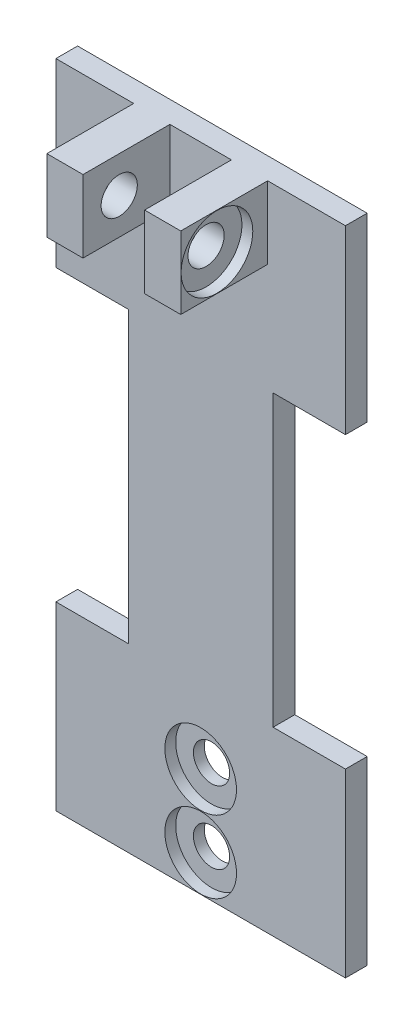
from build123d import *

# Parameters (mm, degrees)
SKETCH1_R             = 4.95
SKETCH1_W             = 5
SKETCH1_H             = 10
SKETCH1_W_2           = 8.5
BODY_DEPTH            = 3
SKETCH1_3_R           = 4.95
SKETCH1_3_R_2         = 2.5
MOUNT_INSETS_DEPTH    = 1.5
SKETCH1_5_W           = 5
SKETCH1_5_H           = 10
HINGE_DEPTH           = 15
SKETCH2_R             = 4.95
SKETCH2_R_2           = 2.5
HINGE_INSET_DEPTH     = 1.5
HINGE_START           = -17
SKETCH2_2_R           = 4.95
SKETCH2_2_R_2         = 2.5
HINGE_INSET2_DEPTH    = 1.5
SKETCH2_3_R           = 2.5
HINGE_SCREWHOLE_DEPTH = 83.165589159


with BuildPart() as part:
    # Sketch1 → Body (new body)
    # profile 1 of 4: a face of its own
    with BuildSketch(Plane.XY):
        Polygon((-23.27588231, 75.303529412), (-34.02588231, 75.303529412), (-34.02588231, 50.303529412), (-24.02588231, 50.303529412), (-24.02588231, 10.303529412), (-34.02588231, 10.303529412), (-34.02588231, -14.696470588), (5.97411769, -14.696470588), (5.97411769, 10.303529412), (-4.02588231, 10.303529412), (-4.02588231, 50.303529412), (5.97411769, 50.303529412), (5.97411769, 75.303529412), (-4.77588231, 75.303529412), (-4.77588231, 65.303529412), (-9.77588231, 65.303529412), (-18.27588231, 65.303529412), (-23.27588231, 65.303529412), align=None)
        with Locations((-14.02588231, -9.696470588)):
            Circle(SKETCH1_R, mode=Mode.SUBTRACT)
        with Locations((-14.02588231, 0.303529412)):
            Circle(SKETCH1_R, mode=Mode.SUBTRACT)
    # profile 2 of 4: a face of its own
    with BuildSketch(Plane.XY):
        with Locations((-20.77588231, 70.303529412)):
            Rectangle(SKETCH1_W, SKETCH1_H)
    # profile 3 of 4: a face of its own
    with BuildSketch(Plane.XY):
        with Locations((-14.02588231, 70.303529412)):
            Rectangle(SKETCH1_W_2, SKETCH1_H)
    # profile 4 of 4: a face of its own
    with BuildSketch(Plane.XY):
        with Locations((-7.27588231, 70.303529412)):
            Rectangle(SKETCH1_W, SKETCH1_H)
    extrude(amount=BODY_DEPTH)

    # Sketch1<3> → Mount Insets (add)
    # profile 1 of 2: a face of its own
    with BuildSketch(Plane.XY):
        with Locations((-14.02588231, 0.303529412)):
            Circle(SKETCH1_3_R)
        with Locations((-14.02588231, 0.303529412)):
            Circle(SKETCH1_3_R_2, mode=Mode.SUBTRACT)
    # profile 2 of 2: a face of its own
    with BuildSketch(Plane.XY):
        with Locations((-14.02588231, -9.696470588)):
            Circle(SKETCH1_3_R)
        with Locations((-14.02588231, -9.696470588)):
            Circle(SKETCH1_3_R_2, mode=Mode.SUBTRACT)
    extrude(amount=MOUNT_INSETS_DEPTH)

    # Sketch1<5> → Hinge (add)
    with BuildSketch(Plane.XY):
        with Locations((-7.27588231, 70.303529412)):
            Rectangle(SKETCH1_5_W, SKETCH1_5_H)
        with Locations((-20.77588231, 70.303529412)):
            Rectangle(SKETCH1_5_W, SKETCH1_5_H)
    extrude(amount=HINGE_DEPTH)

    # Sketch2 → Hinge Inset (cut)
    with BuildSketch(Plane(origin=(-4.77588231, 0, 0), x_dir=(0, 0, -1), z_dir=(1, 0, 0))):
        with Locations((-10, 70.303529412)):
            Circle(SKETCH2_R)
        with Locations((-10, 70.303529412)):
            Circle(SKETCH2_R_2, mode=Mode.SUBTRACT)
    extrude(amount=-HINGE_INSET_DEPTH, mode=Mode.SUBTRACT)

    # Sketch2<2> → Hinge Inset2 (cut)
    with BuildSketch(Plane(origin=(-4.77588231, 0, 0), x_dir=(0, 0, -1), z_dir=(1, 0, 0)).offset(HINGE_START)):
        with Locations((-10, 70.303529412)):
            Circle(SKETCH2_2_R)
        with Locations((-10, 70.303529412)):
            Circle(SKETCH2_2_R_2, mode=Mode.SUBTRACT)
    extrude(amount=-HINGE_INSET2_DEPTH, mode=Mode.SUBTRACT)

    # Sketch2<3> → Hinge Screwhole (cut, through all)
    with BuildSketch(Plane(origin=(-4.77588231, 0, 0), x_dir=(0, 0, -1), z_dir=(1, 0, 0))):
        with Locations(Location((-10, 70.303529412, 0), (0, 0, 180))):
            Circle(SKETCH2_3_R)
    extrude(amount=-HINGE_SCREWHOLE_DEPTH, mode=Mode.SUBTRACT)


solid = part.part
